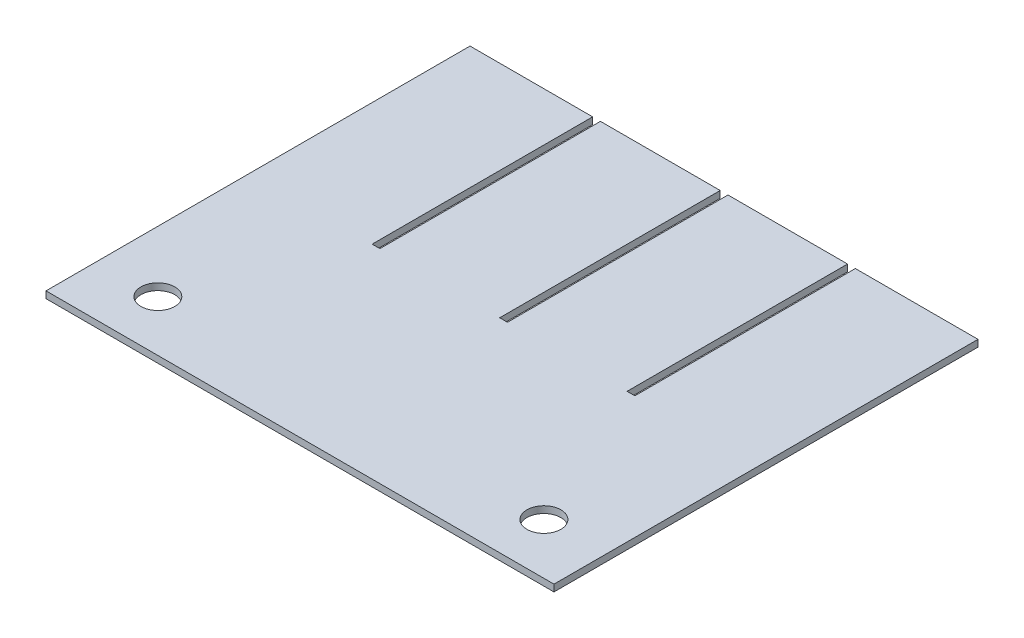
from build123d import *

# Parameters (mm, degrees)
SKETCH1_R           = 5
BOSS_EXTRUDE1_DEPTH = 2


with BuildPart() as part:
    # Sketch1 → Boss-Extrude1 (new body)
    with BuildSketch(Plane(origin=(0, 0, 0), x_dir=(1, 0, 0), z_dir=(0, 1, 0))):
        Polygon((1.175, 62.5), (36.425, 62.5), (36.425, -2.5), (38.725, -2.5), (38.725, 62.5), (74.875, 62.5), (74.875, -62.5), (-74.875, -62.5), (-74.875, 62.5), (-38.725, 62.5), (-38.725, -2.5), (-36.425, -2.5), (-36.425, 62.5), (-1.125, 62.5), (-1.125, -2.5), (1.175, -2.5), align=None)
        with Locations(Location((-56.905, -47.5, 0), (0, 0, 270))):
            Circle(SKETCH1_R, mode=Mode.SUBTRACT)
        with Locations(Location((56.905, -47.5, 0), (0, 0, 270))):
            Circle(SKETCH1_R, mode=Mode.SUBTRACT)
    extrude(amount=BOSS_EXTRUDE1_DEPTH)


solid = part.part
